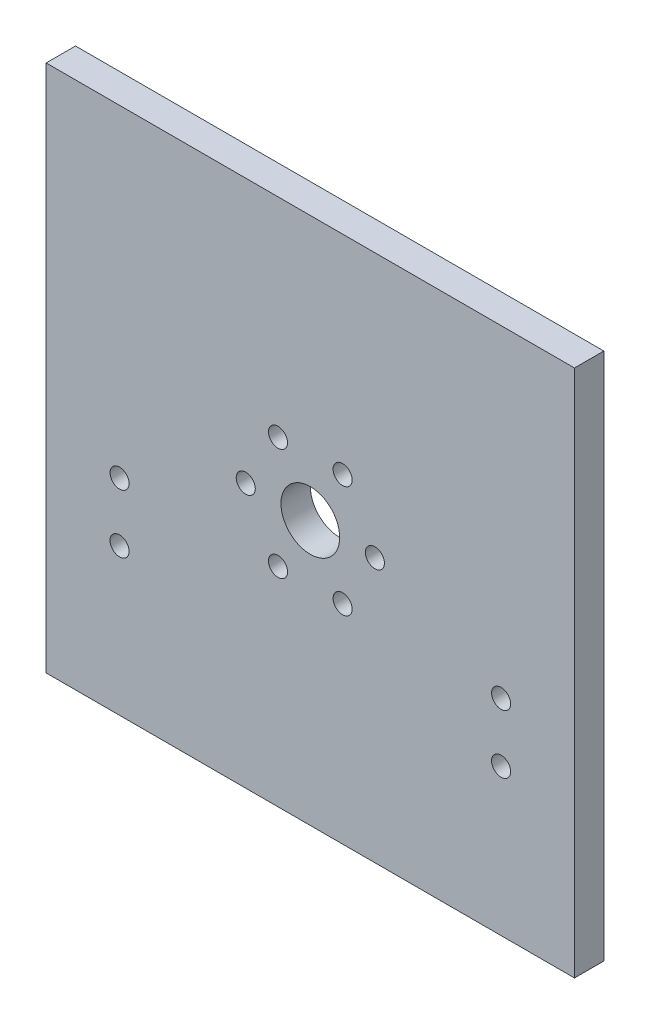
from build123d import *

# Parameters (mm, degrees)
SKETCH_1_W          = 180
SKETCH_1_H          = 180
EXTRUDE_1_DEPTH     = 10
SKETCH_2_R          = 10
SKETCH_2_R_2        = 3.25
CUT_EXTRUDE_1_DEPTH = 11


with BuildPart() as part:
    # 草图1 → 凸台-拉伸1 (new body)
    with BuildSketch(Plane.XY):
        Rectangle(SKETCH_1_W, SKETCH_1_H)
    extrude(amount=EXTRUDE_1_DEPTH)

    # 草图2 → 切除-拉伸1 (cut)
    with BuildSketch(Plane(origin=(0, 0, 0), x_dir=(-1, 0, 0), z_dir=(0, 0, -1))):
        Circle(SKETCH_2_R)
        with Locations((-22, 0)):
            Circle(SKETCH_2_R_2)
        with Locations((-11, 19.052558883)):
            Circle(SKETCH_2_R_2)
        with Locations((11, 19.052558883)):
            Circle(SKETCH_2_R_2)
        with Locations((22, 0)):
            Circle(SKETCH_2_R_2)
        with Locations((11, -19.052558883)):
            Circle(SKETCH_2_R_2)
        with Locations((-11, -19.052558883)):
            Circle(SKETCH_2_R_2)
        with Locations((65, -20)):
            Circle(SKETCH_2_R_2)
        with Locations((65, -40)):
            Circle(SKETCH_2_R_2)
        with Locations((-65, -20)):
            Circle(SKETCH_2_R_2)
        with Locations((-65, -40)):
            Circle(SKETCH_2_R_2)
    extrude(amount=-CUT_EXTRUDE_1_DEPTH, mode=Mode.SUBTRACT)


solid = part.part
